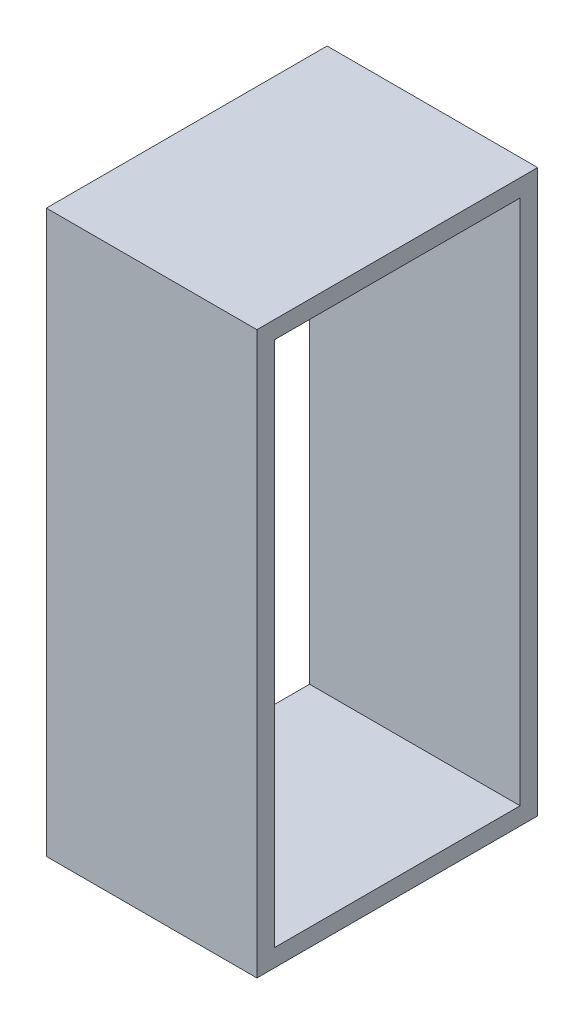
from build123d import *

# Parameters (mm, degrees)
SKETCH1_W           = 25.4
SKETCH1_H           = 50.8
SKETCH1_W_2         = 22.225
SKETCH1_H_2         = 47.625
BOSS_EXTRUDE1_DEPTH = 19.05


with BuildPart() as part:
    # Sketch1 → Boss-Extrude1 (new body)
    with BuildSketch(Plane(origin=(0, 0, 0), x_dir=(0, 0, -1), z_dir=(1, 0, 0))):
        Rectangle(SKETCH1_W, SKETCH1_H)
        Rectangle(SKETCH1_W_2, SKETCH1_H_2, mode=Mode.SUBTRACT)
    extrude(amount=BOSS_EXTRUDE1_DEPTH)


solid = part.part
